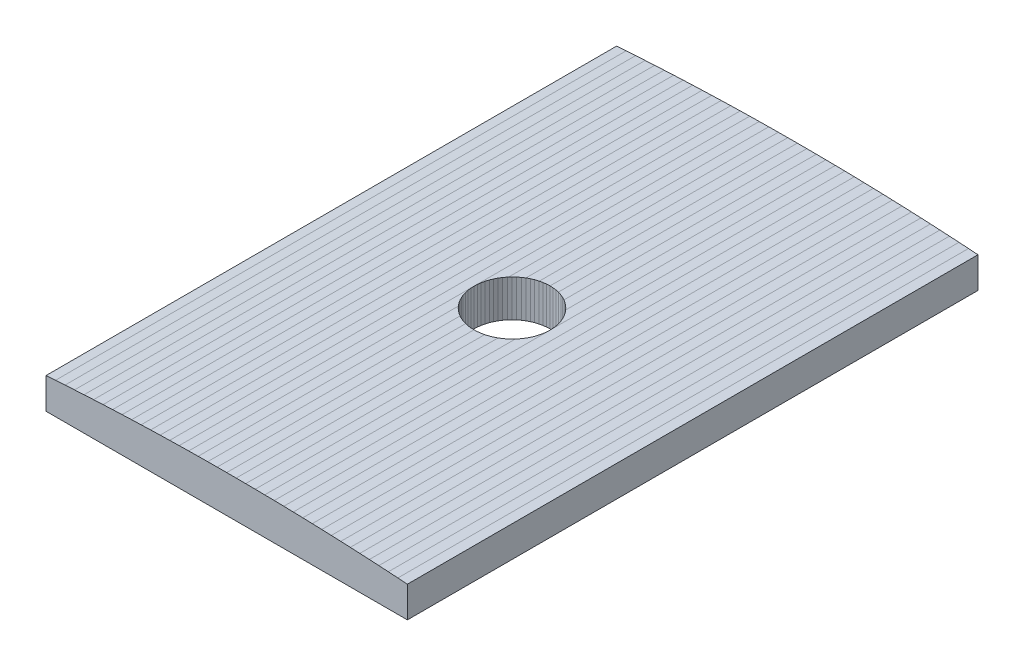
from build123d import *

# Parameters (mm, degrees)
ARCHED_FLOAT_DEPTH             = 600
TETHER_PASS_THROUGH_DEPTH      = 644.717254264
TETHER_PASS_THROUGH_DEPTH_BACK = 644.717254264


with BuildPart() as part:
    # 草图1 → Arched_float (new body)
    with BuildSketch(Plane.XY):
        Polygon((-190, 96), (190, 96), (190, 128.534010774), (180, 129.214523018), (170, 129.858251246), (160, 130.465194796), (150, 131.035353667), (140, 131.568728191), (130, 132.065318368), (120, 132.525124198), (110, 132.948145349), (100, 133.334382153), (90, 133.683834279), (80, 133.996502389), (70, 134.272385821), (60, 134.511484574), (50, 134.71379898), (40, 134.879329039), (30, 135.008074751), (20, 135.100035784), (10, 135.15521247), (0, 135.17360481), (-10, 135.15521247), (-20, 135.100035784), (-30, 135.008074751), (-40, 134.879329039), (-50, 134.71379898), (-60, 134.511484574), (-70, 134.272385821), (-80, 133.996502389), (-90, 133.683834279), (-100, 133.334382153), (-110, 132.948145349), (-120, 132.525124198), (-130, 132.065318368), (-140, 131.568728191), (-150, 131.035353667), (-160, 130.465194796), (-170, 129.858251246), (-180, 129.214523018), (-190, 128.534010774), align=None)
    extrude(amount=ARCHED_FLOAT_DEPTH)

    # 草图2 → Tether_pass_through (cut, two sides: drawn at the far end of the back side and taken through both)
    with BuildSketch(Plane(origin=(0, 0, 0), x_dir=(1, 0, 0), z_dir=(0, 1, 0)).offset(-TETHER_PASS_THROUGH_DEPTH_BACK)):
        Polygon((40, -300), (39.847787924, -303.48622971), (39.39231012, -306.945927107), (38.637033052, -310.352761804), (37.587704831, -313.680805733), (36.252311481, -316.90473047), (34.641016151, -320), (32.766081772, -322.943057454), (30.641777725, -325.711504387), (28.284271247, -328.284271247), (25.711504387, -330.641777725), (22.943057454, -332.766081772), (20, -334.641016151), (16.90473047, -336.252311481), (13.680805733, -337.587704831), (10.352761804, -338.637033052), (6.945927107, -339.39231012), (3.48622971, -339.847787924), (0, -340), (-3.48622971, -339.847787924), (-6.945927107, -339.39231012), (-10.352761804, -338.637033052), (-13.680805733, -337.587704831), (-16.90473047, -336.252311481), (-20, -334.641016151), (-22.943057454, -332.766081772), (-25.711504387, -330.641777725), (-28.284271247, -328.284271247), (-30.641777725, -325.711504387), (-32.766081772, -322.943057454), (-34.641016151, -320), (-36.252311481, -316.90473047), (-37.587704831, -313.680805733), (-38.637033052, -310.352761804), (-39.39231012, -306.945927107), (-39.847787924, -303.48622971), (-40, -300), (-39.847787924, -296.51377029), (-39.39231012, -293.054072893), (-38.637033052, -289.647238196), (-37.587704831, -286.319194267), (-36.252311481, -283.09526953), (-34.641016151, -280), (-32.766081772, -277.056942546), (-30.641777725, -274.288495613), (-28.284271247, -271.715728753), (-25.711504387, -269.358222275), (-22.943057454, -267.233918228), (-20, -265.358983849), (-16.90473047, -263.747688519), (-13.680805733, -262.412295169), (-10.352761804, -261.362966948), (-6.945927107, -260.60768988), (-3.48622971, -260.152212076), (0, -260), (3.48622971, -260.152212076), (6.945927107, -260.60768988), (10.352761804, -261.362966948), (13.680805733, -262.412295169), (16.90473047, -263.747688519), (20, -265.358983849), (22.943057454, -267.233918228), (25.711504387, -269.358222275), (28.284271247, -271.715728753), (30.641777725, -274.288495613), (32.766081772, -277.056942546), (34.641016151, -280), (36.252311481, -283.09526953), (37.587704831, -286.319194267), (38.637033052, -289.647238196), (39.39231012, -293.054072893), (39.847787924, -296.51377029), align=None)
    extrude(amount=TETHER_PASS_THROUGH_DEPTH + TETHER_PASS_THROUGH_DEPTH_BACK, mode=Mode.SUBTRACT)


solid = part.part
